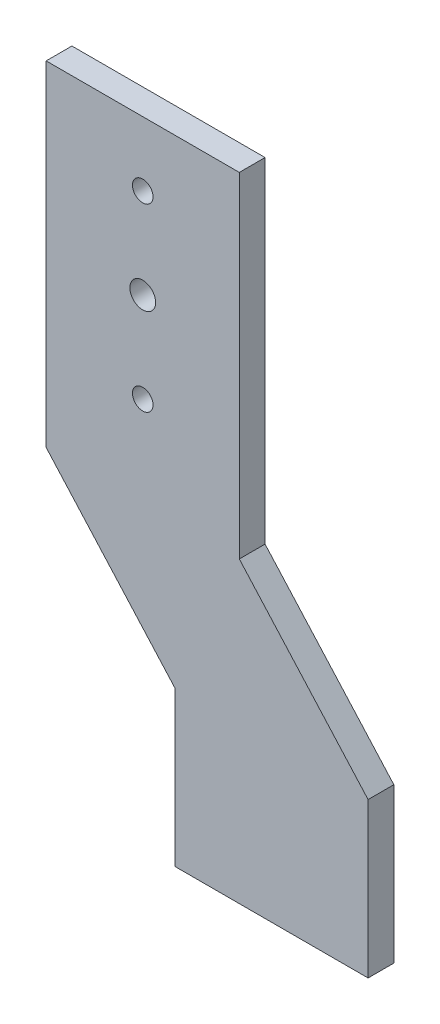
from build123d import *

# Parameters (mm, degrees)
BOSS_EXTRUDE1_DEPTH    = 10
F_8_0MM_DOWEL_HOLE5_D  = 8
F_10_0MM_DOWEL_HOLE1_D = 10


with BuildPart() as part:
    # Sketch1 → Boss-Extrude1 (new body)
    with BuildSketch(Plane.XY):
        Polygon((0, 245.901699437), (75, 245.901699437), (75, 115.901699437), (125, 60), (125, 0), (50, 0), (50, 60), (0, 115.901699437), align=None)
    extrude(amount=BOSS_EXTRUDE1_DEPTH)

    # Ø8.0mm Dowel Hole5 (through all)
    with Locations(Plane.XY.offset(10)):
        with Locations((37.5, 220.901699437), (37.5, 150.901699437)):
            Hole(F_8_0MM_DOWEL_HOLE5_D / 2)

    # Ø10.0mm Dowel Hole1 (through all)
    with Locations(Plane.XY.offset(10)):
        with Locations((37.5, 185.901699437)):
            Hole(F_10_0MM_DOWEL_HOLE1_D / 2)


solid = part.part
